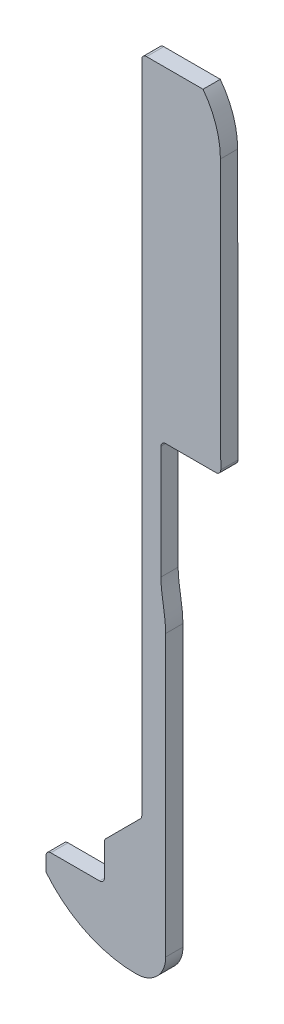
from build123d import *

# Parameters (mm, degrees)
BOSS_EXTRUDE1_DEPTH = 1.8
FILLET1_R           = 0.5


with BuildPart() as part:
    # Sketch1 → Boss-Extrude1 (new body)
    with BuildSketch(Plane.XY):
        with BuildLine():
            Line((0, 4.5), (0, 6.5))
            Line((0, 6.5), (6.1, 6.5))
            Line((6.1, 6.5), (6.1, 10.5))
            Line((6.1, 10.5), (10, 14.4))
            Line((10, 14.4), (10, 83.5))
            Line((10, 83.5), (16.4, 83.5))
            ThreePointArc((16.4, 83.5), (17.745328581, 80.945017946), (18.212299295, 78.095495067))
            Line((18.212299295, 78.095495067), (18.25, 49.5))
            Line((18.25, 49.5), (12, 49.5))
            Line((12, 49.5), (12, 37.18))
            add(Edge.make_bspline(
                [(12, 37.18), (12, 35.554764974), (12.5, 33.972282338), (12.5, 32.33)],
                knots=[0, 0, 0, 0, 1, 1, 1, 1], degree=3))
            Line((12.5, 32.33), (12.5, 3.07))
            ThreePointArc((12.5, 3.07), (11.600817818, 0.899182182), (9.43, 0))
            ThreePointArc((9.43, 0), (4.205660329, 1.182650422), (0, 4.5))
        make_face()
    extrude(amount=BOSS_EXTRUDE1_DEPTH)

    # Fillet1
    fillet1_edges = [part.edges().sort_by_distance(p)[0] for p in [
        (0, 6.5, 0.9),
        (6.1, 6.5, 0.9),
        (6.1, 10.5, 0.9),
        (10, 14.4, 0.9),
        (10, 83.5, 0.9),
        (18.25, 49.5, 0.9),
        (12, 49.5, 0.9),
    ]]
    fillet(fillet1_edges, radius=FILLET1_R)


solid = part.part
